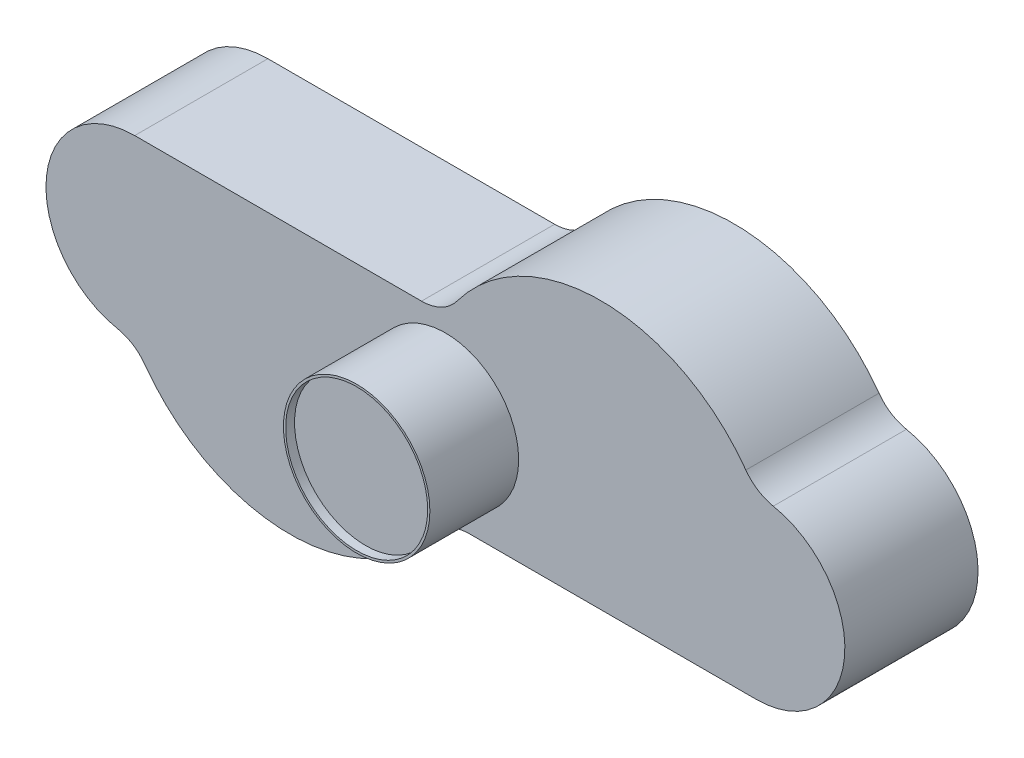
from build123d import *

# Parameters (mm, degrees)
BOSS_EXTRUDE5_DEPTH = 15
SKETCH5_R           = 8.25
BOSS_EXTRUDE6_DEPTH = 10
SKETCH6_R           = 8
CUT_EXTRUDE2_DEPTH  = 1
FILLET3_R           = 5


with BuildPart() as part:
    # Sketch1 → Boss-Extrude5 (new body)
    with BuildSketch(Plane.XY):
        with BuildLine():
            Line((35, 10), (0, 10))
            ThreePointArc((0, 10), (-10, 0), (0, -10))
            Line((0, -10), (35, -10))
            Line((35, -10), (70, -10))
            ThreePointArc((70, -10), (80, 0), (70, 10))
            Line((70, 10), (35, 10))
        make_face()
        with BuildLine():
            ThreePointArc((70, 10), (52.5, 20.155644371), (35, 10))
            Line((35, 10), (70, 10))
        make_face()
        with BuildLine():
            Line((35, -10), (0, -10))
            ThreePointArc((0, -10), (17.5, -20.155644371), (35, -10))
        make_face()
    extrude(amount=BOSS_EXTRUDE5_DEPTH)

    # Sketch5 → Boss-Extrude6 (add)
    with BuildSketch(Plane.XY.offset(15)):
        with Locations((35, 0)):
            Circle(SKETCH5_R)
    extrude(amount=BOSS_EXTRUDE6_DEPTH)

    # Sketch6 → Cut-Extrude2 (cut)
    with BuildSketch(Plane.XY.offset(25)):
        with Locations((35, 0)):
            Circle(SKETCH6_R)
    extrude(amount=-CUT_EXTRUDE2_DEPTH, mode=Mode.SUBTRACT)

    # Fillet3
    fillet3_edges = [part.edges().sort_by_distance(p)[0] for p in [
        (35, -10, 7.5),
        (0, -10, 7.5),
        (35, 10, 7.5),
        (70, 10, 7.5),
    ]]
    fillet(fillet3_edges, radius=FILLET3_R)


solid = part.part
